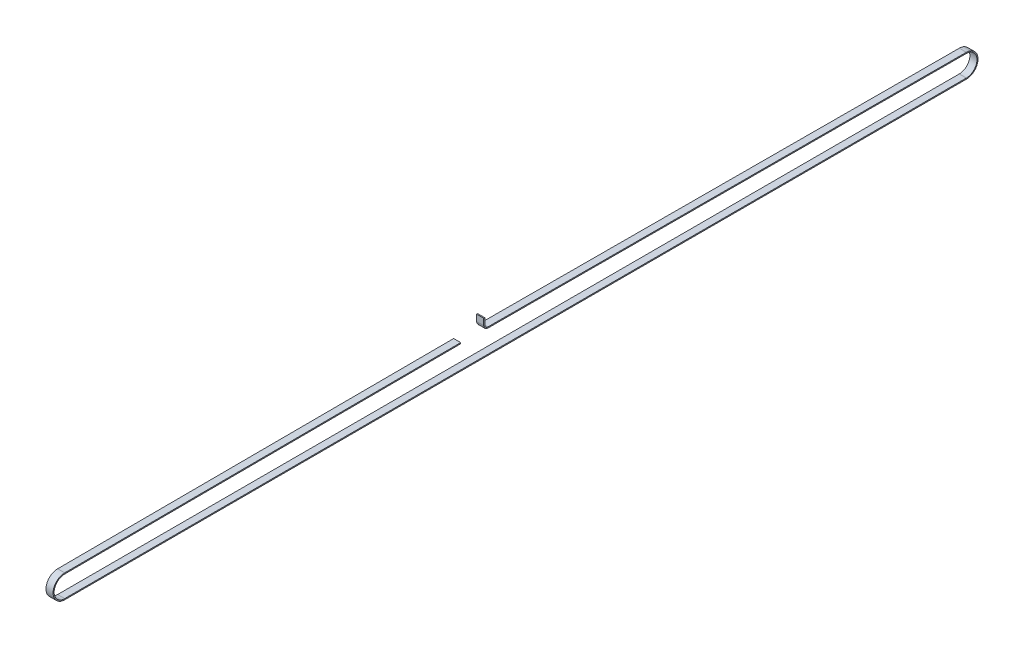
from build123d import *

# Parameters (mm, degrees)
EXTRUDE_THIN1_DEPTH = 5


with BuildPart() as part:
    # Sketch1 → Extrude-Thin1 (new, symmetric)
    with BuildSketch(Plane(origin=(0, 0, 0), x_dir=(0, 0, -1), z_dir=(1, 0, 0))):
        with BuildLine():
            Line((-77.503218133, 17.000038263), (-637.553569857, 14.999904342))
            ThreePointArc((-637.553569857, 14.999904342), (-652.499976085, -0.026784971), (-637.5, -15))
            Line((-637.5, -15), (637.5, -15))
            ThreePointArc((637.5, -15), (652.499983614, -0.022171887), (637.544343726, 14.999934454))
            Line((637.544343726, 14.999934454), (-39.020955624, 17.000038263))
            ThreePointArc((-39.020955624, 17.000038263), (-43.252125342, 18.763647149), (-45.003218133, 23.000012045))
            Line((-45.003218133, 23.000012045), (-45.003218133, 32.000038263))
            Line((-45.003218133, 32.000038263), (-43.503218133, 32.000038263))
            Line((-43.503218133, 32.000038263), (-43.503218133, 23.000012045))
            ThreePointArc((-43.503218133, 23.000012045), (-42.18989854, 19.822738373), (-39.016521251, 18.500031709))
            Line((-39.016521251, 18.500031709), (637.548778098, 16.4999279))
            ThreePointArc((637.548778098, 16.4999279), (653.999981975, -0.024389076), (637.5, -16.5))
            Line((637.5, -16.5), (-637.5, -16.5))
            ThreePointArc((-637.5, -16.5), (-653.999973694, -0.029463469), (-637.558926843, 16.499894776))
            Line((-637.558926843, 16.499894776), (-77.508575119, 18.500028697))
            Line((-77.508575119, 18.500028697), (-77.503218133, 17.000038263))
        make_face()
    extrude(amount=EXTRUDE_THIN1_DEPTH, both=True)


solid = part.part
